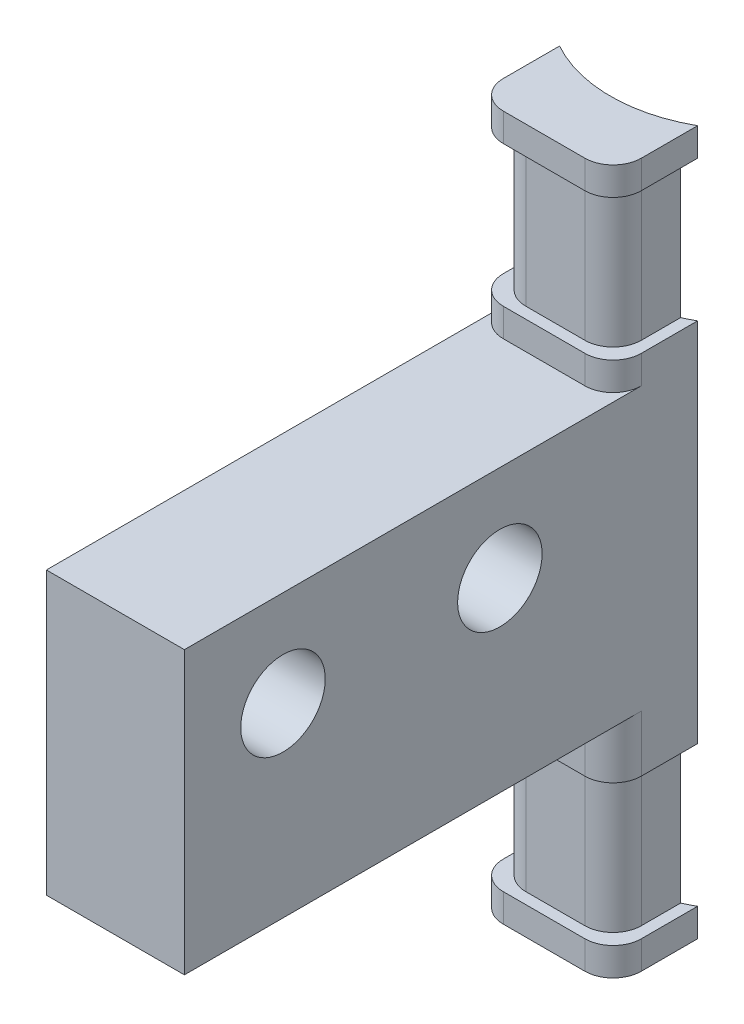
from build123d import *

# Parameters (mm, degrees)
SKETCH2_W                = 6.223
SKETCH2_H                = 12.7
BOSS_EXTRUDE1_DEPTH      = 19.3294
SKETCH3_R                = 1.905
CUT_EXTRUDE1_DEPTH       = 19.3294
BOSS_EXTRUDE2_DEPTH      = 8.89
BOSS_EXTRUDE2_DEPTH_BACK = 22.86
CUT_EXTRUDE2_START       = -7.62
CUT_EXTRUDE2_DEPTH       = 6.35
FILLET1_R                = 1.27


with BuildPart() as part:
    # Sketch2 → Boss-Extrude1 (new body)
    with BuildSketch(Plane.XY):
        with Locations((3.1115, 6.35)):
            Rectangle(SKETCH2_W, SKETCH2_H)
    extrude(amount=BOSS_EXTRUDE1_DEPTH)

    # Sketch3 → Cut-Extrude1 (cut)
    with BuildSketch(Plane(origin=(6.223, 0, 0), x_dir=(0, 0, -1), z_dir=(1, 0, 0))):
        with Locations(Location((-14.8844, 8.382, 0), (0, 0, 90))):
            Circle(SKETCH3_R)
        with Locations(Location((-5.1054, 8.382, 0), (0, 0, 90))):
            Circle(SKETCH3_R)
    extrude(amount=-CUT_EXTRUDE1_DEPTH, mode=Mode.SUBTRACT)

    # Sketch4 → Boss-Extrude2 (add, two sides: drawn at the far end of the back side and taken through both)
    with BuildSketch(Plane(origin=(0, 12.7, 0), x_dir=(1, 0, 0), z_dir=(0, 1, 0)).offset(-BOSS_EXTRUDE2_DEPTH_BACK)):
        with BuildLine():
            Line((6.223, 3.81), (6.223, 0))
            Line((6.223, 0), (0, 0))
            Line((0, 0), (0, 3.81))
            ThreePointArc((0, 3.81), (3.1115, 2.995437449), (6.223, 3.81))
        make_face()
    extrude(amount=BOSS_EXTRUDE2_DEPTH + BOSS_EXTRUDE2_DEPTH_BACK)

    # Sketch5 → Cut-Extrude2 (cut)
    with BuildSketch(Plane(origin=(0, 21.59, 0), x_dir=(1, 0, 0), z_dir=(0, 1, 0)).offset(CUT_EXTRUDE2_START)):
        with BuildLine():
            Line((5.715, 0.508), (5.715, 3.000837245))
            Line((5.715, 3.000837245), (5.715, 3.553694382))
            ThreePointArc((5.715, 3.553694382), (5.971872247, 3.676154372), (6.223, 3.81))
            Line((6.223, 3.81), (6.223, 0))
            Line((6.223, 0), (0, 0))
            Line((0, 0), (0, 3.81))
            ThreePointArc((0, 3.81), (0.251127753, 3.676154372), (0.508, 3.553694382))
            Line((0.508, 3.553694382), (0.508, 3.000837245))
            Line((0.508, 3.000837245), (0.508, 0.508))
            Line((0.508, 0.508), (5.715, 0.508))
        make_face()
    cut_extrude2 = extrude(amount=CUT_EXTRUDE2_DEPTH, mode=Mode.SUBTRACT)

    # Mirror1: Cut-Extrude2 across plane
    add(cut_extrude2.mirror(Plane.ZX.offset(5.715)), mode=Mode.SUBTRACT)

    # Fillet1
    fillet1_edges = [part.edges().sort_by_distance(p)[0] for p in [
        (6.223, 13.335, 0),
        (6.223, -9.525, 0),
        (0, -9.525, 0),
        (0, 13.335, 0),
        (6.223, 20.955, 0),
        (0, 20.955, 0),
        (0.508, 17.145, -0.508),
        (5.715, 17.145, -0.508),
        (0, -1.27, 0),
        (6.223, -1.27, 0),
        (5.715, -5.715, -0.508),
        (0.508, -5.715, -0.508),
    ]]
    fillet(fillet1_edges, radius=FILLET1_R)


solid = part.part
